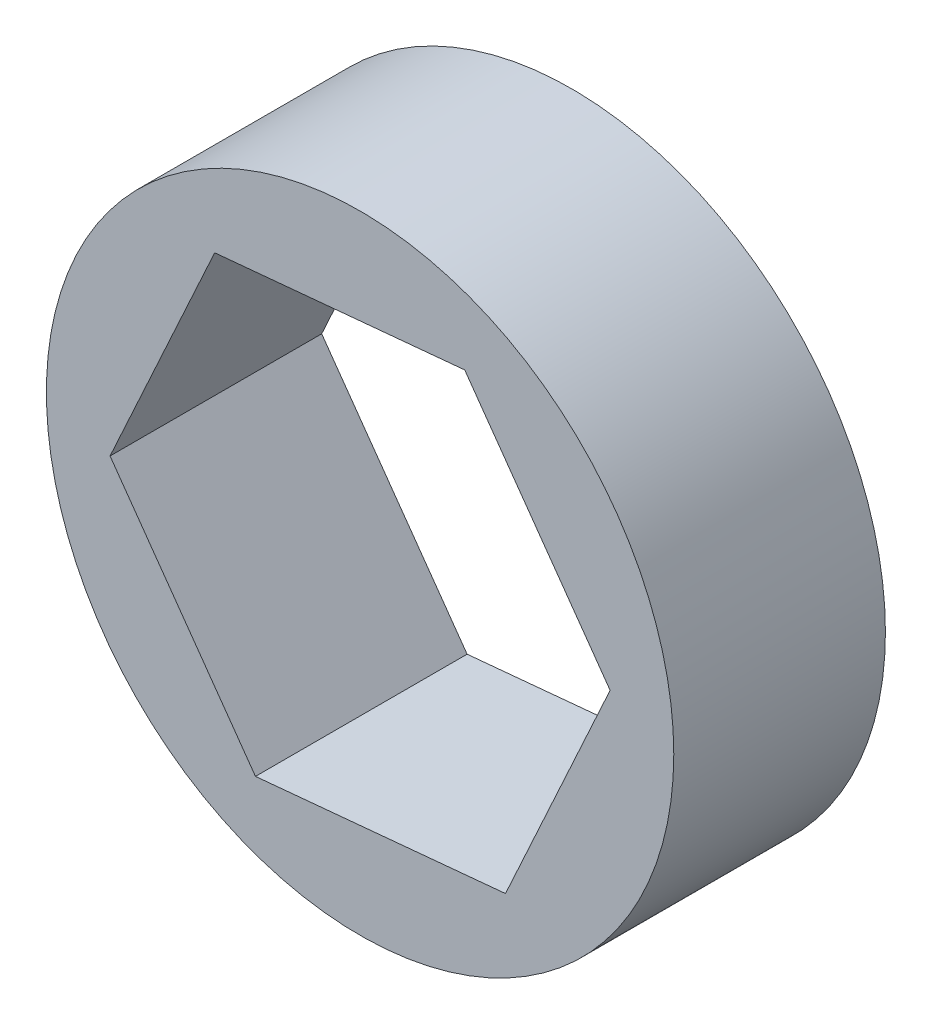
from build123d import *

# Parameters (mm, degrees)
SKETCH1_R           = 9.525
BOSS_EXTRUDE1_DEPTH = 6.4262


with BuildPart() as part:
    # Sketch1 → Boss-Extrude1 (new body)
    with BuildSketch(Plane.XY):
        Circle(SKETCH1_R)
        Polygon((-4.415250563, 6.21739365), (-7.592046128, -0.715022327), (-3.176795565, -6.932415977), (4.415250563, -6.21739365), (7.592046128, 0.715022327), (3.176795565, 6.932415977), align=None, mode=Mode.SUBTRACT)
    extrude(amount=BOSS_EXTRUDE1_DEPTH)


solid = part.part
